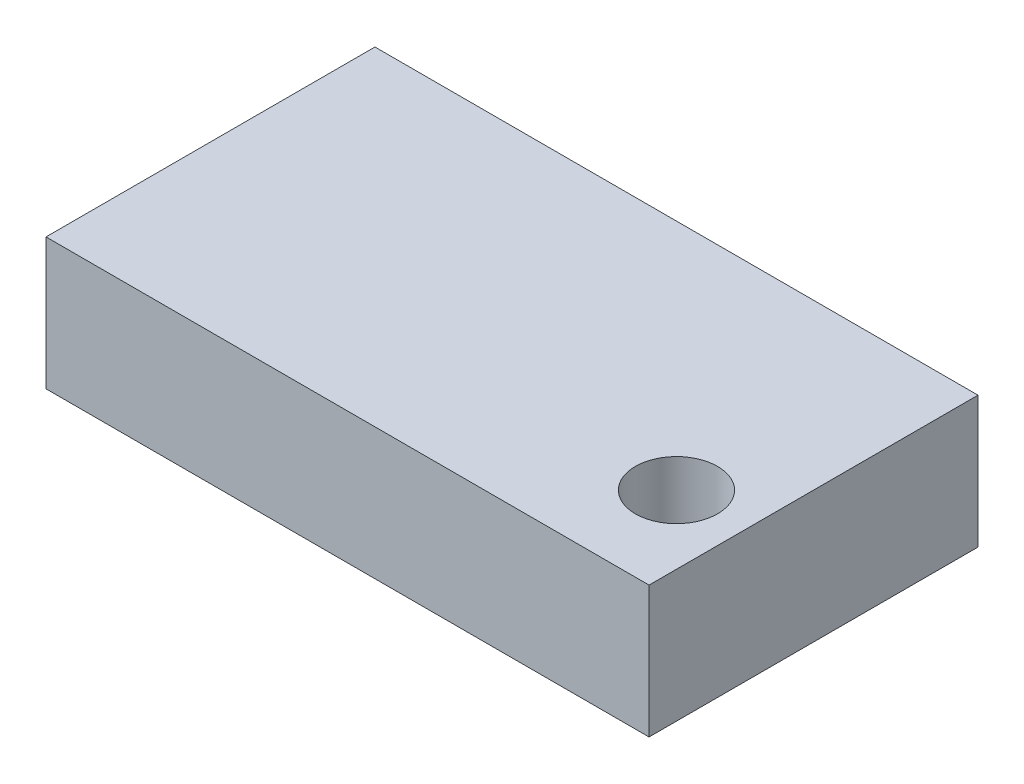
from build123d import *

# Parameters (mm, degrees)
SKETCH1_W           = 22
SKETCH1_H           = 12
SKETCH1_R           = 1.5
BOSS_EXTRUDE1_DEPTH = 4.8


with BuildPart() as part:
    # Sketch1 → Boss-Extrude1 (new body)
    with BuildSketch(Plane(origin=(0, 0, 0), x_dir=(1, 0, 0), z_dir=(0, 1, 0))):
        Rectangle(SKETCH1_W, SKETCH1_H)
        with Locations(Location((8.5, -2.5, 0), (0, 0, 270))):
            Circle(SKETCH1_R, mode=Mode.SUBTRACT)
    extrude(amount=BOSS_EXTRUDE1_DEPTH)


solid = part.part
